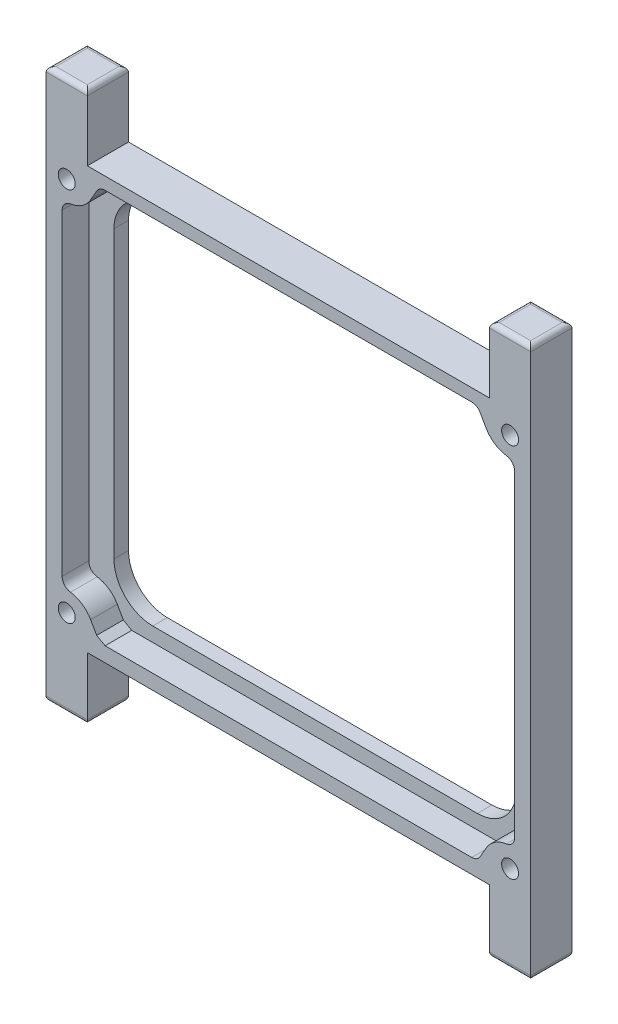
from build123d import *

# Parameters (mm, degrees)
SKETCH1_W           = 100
SKETCH1_H           = 113.5
BOSS_EXTRUDE1_DEPTH = 8.5
CUT_EXTRUDE1_REACH  = 78.111
SKETCH2_W           = 83
SKETCH2_H           = 13.5
SKETCH2_H_2         = 13
SKETCH2_W_2         = 10
SKETCH2_H_3         = 10
SKETCH2_R           = 1.75
CUT_EXTRUDE2_REACH  = 78.111
SKETCH6_W           = 10
SKETCH6_H           = 10
FILLET1_R           = 1
SKETCH8_W           = 10
SKETCH8_H           = 10
CUT_EXTRUDE5_DEPTH  = 5.5
CUT_EXTRUDE6_DEPTH  = 76.834111718


with BuildPart() as part:
    # Sketch1 → Boss-Extrude1 (new body)
    with BuildSketch(Plane.XY):
        Rectangle(SKETCH1_W, SKETCH1_H)
    extrude(amount=BOSS_EXTRUDE1_DEPTH)

    # Sketch2 → Cut-Extrude1 (cut, up to next)
    with BuildSketch(Plane.XY.offset(8.5), mode=Mode.PRIVATE) as cut_extrude1_sk1:
        with Locations((0, 50)):
            Rectangle(SKETCH2_W, SKETCH2_H)
    cut_extrude1_tool1 = extrude(cut_extrude1_sk1.sketch, amount=-CUT_EXTRUDE1_REACH, mode=Mode.PRIVATE) & part.part
    # Sketch2 → Cut-Extrude1 (cut, up to next)
    with BuildSketch(Plane.XY.offset(8.5), mode=Mode.PRIVATE) as cut_extrude1_sk2:
        with BuildLine():
            ThreePointArc((-41.5, -29.75), (-39.156854249, -35.406854249), (-33.5, -37.75))
            Line((-33.5, -37.75), (33.5, -37.75))
            ThreePointArc((33.5, -37.75), (39.156854249, -35.406854249), (41.5, -29.75))
            Line((41.5, -29.75), (41.5, -0.25))
            Line((41.5, -0.25), (-41.5, -0.25))
            Line((-41.5, -0.25), (-41.5, -29.75))
        make_face()
    cut_extrude1_tool2 = extrude(cut_extrude1_sk2.sketch, amount=-CUT_EXTRUDE1_REACH, mode=Mode.PRIVATE) & part.part
    # Sketch2 → Cut-Extrude1 (cut, up to next)
    with BuildSketch(Plane.XY.offset(8.5), mode=Mode.PRIVATE) as cut_extrude1_sk3:
        with Locations((0, -50.25)):
            Rectangle(SKETCH2_W, SKETCH2_H_2)
    cut_extrude1_tool3 = extrude(cut_extrude1_sk3.sketch, amount=-CUT_EXTRUDE1_REACH, mode=Mode.PRIVATE) & part.part
    # Sketch2 → Cut-Extrude1 (cut, up to next)
    with BuildSketch(Plane.XY.offset(8.5), mode=Mode.PRIVATE) as cut_extrude1_sk4:
        with Locations((-11.75, 22.75)):
            Rectangle(SKETCH2_W_2, SKETCH2_H_3)
    cut_extrude1_tool4 = extrude(cut_extrude1_sk4.sketch, amount=-CUT_EXTRUDE1_REACH, mode=Mode.PRIVATE) & part.part
    # Sketch2 → Cut-Extrude1 (cut, up to next)
    with BuildSketch(Plane.XY.offset(8.5), mode=Mode.PRIVATE) as cut_extrude1_sk5:
        with Locations((45.75, 38.75)):
            Circle(SKETCH2_R)
    cut_extrude1_tool5 = extrude(cut_extrude1_sk5.sketch, amount=-CUT_EXTRUDE1_REACH, mode=Mode.PRIVATE) & part.part
    # Sketch2 → Cut-Extrude1 (cut, up to next)
    with BuildSketch(Plane.XY.offset(8.5), mode=Mode.PRIVATE) as cut_extrude1_sk6:
        with Locations((45.75, -38.75)):
            Circle(SKETCH2_R)
    cut_extrude1_tool6 = extrude(cut_extrude1_sk6.sketch, amount=-CUT_EXTRUDE1_REACH, mode=Mode.PRIVATE) & part.part
    # Sketch2 → Cut-Extrude1 (cut, up to next)
    with BuildSketch(Plane.XY.offset(8.5), mode=Mode.PRIVATE) as cut_extrude1_sk7:
        with Locations((-45.75, 38.75)):
            Circle(SKETCH2_R)
    cut_extrude1_tool7 = extrude(cut_extrude1_sk7.sketch, amount=-CUT_EXTRUDE1_REACH, mode=Mode.PRIVATE) & part.part
    # Sketch2 → Cut-Extrude1 (cut, up to next)
    with BuildSketch(Plane.XY.offset(8.5), mode=Mode.PRIVATE) as cut_extrude1_sk8:
        with Locations((-45.75, -38.75)):
            Circle(SKETCH2_R)
    cut_extrude1_tool8 = extrude(cut_extrude1_sk8.sketch, amount=-CUT_EXTRUDE1_REACH, mode=Mode.PRIVATE) & part.part
    add(cut_extrude1_tool1.solids().sort_by_distance((0, 50, 8.5))[0], mode=Mode.SUBTRACT)
    add(cut_extrude1_tool2.solids().sort_by_distance((0, -18.848961, 8.5))[0], mode=Mode.SUBTRACT)
    add(cut_extrude1_tool3.solids().sort_by_distance((0, -50.25, 8.5))[0], mode=Mode.SUBTRACT)
    add(cut_extrude1_tool4.solids().sort_by_distance((-11.75, 22.75, 8.5))[0], mode=Mode.SUBTRACT)
    add(cut_extrude1_tool5.solids().sort_by_distance((45.75, 38.75, 8.5))[0], mode=Mode.SUBTRACT)
    add(cut_extrude1_tool6.solids().sort_by_distance((45.75, -38.75, 8.5))[0], mode=Mode.SUBTRACT)
    add(cut_extrude1_tool7.solids().sort_by_distance((-45.75, 38.75, 8.5))[0], mode=Mode.SUBTRACT)
    add(cut_extrude1_tool8.solids().sort_by_distance((-45.75, -38.75, 8.5))[0], mode=Mode.SUBTRACT)

    # Sketch6 → Cut-Extrude2 (cut, up to next)
    with BuildSketch(Plane.XY.offset(8.5), mode=Mode.PRIVATE) as cut_extrude2_sk1:
        with BuildLine():
            Line((41.5, 8.25), (41.5, 29.25))
            ThreePointArc((41.5, 29.25), (39.156854249, 34.906854249), (33.5, 37.25))
            Line((33.5, 37.25), (28.5, 37.25))
            Line((28.5, 37.25), (28.5, 8.25))
            Line((28.5, 8.25), (33.5, 8.25))
            Line((33.5, 8.25), (41.5, 8.25))
        make_face()
    cut_extrude2_tool1 = extrude(cut_extrude2_sk1.sketch, amount=-CUT_EXTRUDE2_REACH, mode=Mode.PRIVATE) & part.part
    # Sketch6 → Cut-Extrude2 (cut, up to next)
    with BuildSketch(Plane.XY.offset(8.5), mode=Mode.PRIVATE) as cut_extrude2_sk2:
        with Locations((11.75, 22.75)):
            Rectangle(SKETCH6_W, SKETCH6_H)
    cut_extrude2_tool2 = extrude(cut_extrude2_sk2.sketch, amount=-CUT_EXTRUDE2_REACH, mode=Mode.PRIVATE) & part.part
    # Sketch6 → Cut-Extrude2 (cut, up to next)
    with BuildSketch(Plane.XY.offset(8.5), mode=Mode.PRIVATE) as cut_extrude2_sk3:
        with BuildLine():
            Line((-41.5, 8.25), (-41.5, 29.25))
            ThreePointArc((-41.5, 29.25), (-39.156854249, 34.906854249), (-33.5, 37.25))
            Line((-33.5, 37.25), (-28.5, 37.25))
            Line((-28.5, 37.25), (-28.5, 8.25))
            Line((-28.5, 8.25), (-33.5, 8.25))
            Line((-33.5, 8.25), (-41.5, 8.25))
        make_face()
    cut_extrude2_tool3 = extrude(cut_extrude2_sk3.sketch, amount=-CUT_EXTRUDE2_REACH, mode=Mode.PRIVATE) & part.part
    add(cut_extrude2_tool1.solids().sort_by_distance((34.821806, 22.269339, 8.5))[0], mode=Mode.SUBTRACT)
    add(cut_extrude2_tool2.solids().sort_by_distance((11.75, 22.75, 8.5))[0], mode=Mode.SUBTRACT)
    add(cut_extrude2_tool3.solids().sort_by_distance((-34.821806, 22.269339, 8.5))[0], mode=Mode.SUBTRACT)

    # Fillet1
    fillet1_edges = [part.edges().sort_by_distance(p)[0] for p in [
        (45.75, -56.75, 0),
        (-45.75, 56.75, 0),
        (-45.75, -56.75, 8.5),
        (-45.75, 56.75, 8.5),
        (45.75, -56.75, 8.5),
        (-41.5, 56.75, 4.25),
        (41.5, 56.75, 4.25),
        (41.5, -56.75, 4.25),
        (-41.5, -56.75, 4.25),
        (-45.75, -56.75, 0),
        (45.75, 56.75, 0),
        (50, -56.75, 4.25),
        (-50, -56.75, 4.25),
        (-50, 56.75, 4.25),
        (50, 56.75, 4.25),
        (45.75, 56.75, 8.5),
    ]]
    fillet(fillet1_edges, radius=FILLET1_R)

    # Sketch8 → Cut-Extrude5 (cut)
    with BuildSketch(Plane.XY.offset(8.5)):
        with BuildLine():
            ThreePointArc((-46.701116722, 32.72), (-46.210984272, 34.031299083), (-44.981116722, 34.7))
            ThreePointArc((-44.981116722, 34.7), (-42.571113581, 35.629410248), (-40.811116722, 37.52))
            Line((-40.811116722, 37.52), (-39.567050808, 39.7))
            ThreePointArc((-39.567050808, 39.7), (-38.836346779, 40.434383498), (-37.835, 40.7))
            Line((-37.835, 40.7), (37.835, 40.7))
            ThreePointArc((37.835, 40.7), (38.836346779, 40.434383498), (39.567050808, 39.7))
            Line((39.567050808, 39.7), (40.811116722, 37.52))
            ThreePointArc((40.811116722, 37.52), (42.571113581, 35.629410248), (44.981116722, 34.7))
            ThreePointArc((44.981116722, 34.7), (46.210984272, 34.031299083), (46.701116722, 32.72))
            Line((46.701116722, 32.72), (46.701116722, -32.72))
            ThreePointArc((46.701116722, -32.72), (46.210984272, -34.031299083), (44.981116722, -34.7))
            ThreePointArc((44.981116722, -34.7), (42.571113581, -35.629410248), (40.811116722, -37.52))
            Line((40.811116722, -37.52), (39.567050808, -39.7))
            ThreePointArc((39.567050808, -39.7), (38.836346779, -40.434383498), (37.835, -40.7))
            Line((37.835, -40.7), (-37.835, -40.7))
            Line((-37.835, -40.7), (-39.567050808, -39.7))
            Line((-39.567050808, -39.7), (-40.811116722, -37.52))
            ThreePointArc((-40.811116722, -37.52), (-42.571113581, -35.629410248), (-44.981116722, -34.7))
            ThreePointArc((-44.981116722, -34.7), (-46.210984272, -34.031299083), (-46.701116722, -32.72))
            Line((-46.701116722, -32.72), (-46.701116722, 32.72))
        make_face()
        with Locations((-11.75, 22.75)):
            Rectangle(SKETCH8_W, SKETCH8_H, mode=Mode.SUBTRACT)
        with BuildLine():
            Line((33.5, -37.75), (-33.5, -37.75))
            ThreePointArc((-33.5, -37.75), (-39.156854249, -35.406854249), (-41.5, -29.75))
            Line((-41.5, -29.75), (-41.5, -0.25))
            Line((-41.5, -0.25), (41.5, -0.25))
            Line((41.5, -0.25), (41.5, -29.75))
            ThreePointArc((41.5, -29.75), (39.156854249, -35.406854249), (33.5, -37.75))
        make_face(mode=Mode.SUBTRACT)
        with Locations((11.75, 22.75)):
            Rectangle(SKETCH8_W, SKETCH8_H, mode=Mode.SUBTRACT)
        with BuildLine():
            Line((-41.5, 8.25), (-41.5, 29.25))
            ThreePointArc((-41.5, 29.25), (-39.156854249, 34.906854249), (-33.5, 37.25))
            Line((-33.5, 37.25), (-28.5, 37.25))
            Line((-28.5, 37.25), (-28.5, 8.25))
            Line((-28.5, 8.25), (-41.5, 8.25))
        make_face(mode=Mode.SUBTRACT)
        with BuildLine():
            Line((41.5, 8.25), (28.5, 8.25))
            Line((28.5, 8.25), (28.5, 37.25))
            Line((28.5, 37.25), (33.5, 37.25))
            ThreePointArc((33.5, 37.25), (39.156854249, 34.906854249), (41.5, 29.25))
            Line((41.5, 29.25), (41.5, 8.25))
        make_face(mode=Mode.SUBTRACT)
    extrude(amount=-CUT_EXTRUDE5_DEPTH, mode=Mode.SUBTRACT)

    # Sketch9 → Cut-Extrude6 (cut, through all)
    with BuildSketch(Plane.XY.offset(3)):
        with BuildLine():
            Line((-33.5, -37.75), (33.5, -37.75))
            ThreePointArc((33.5, -37.75), (39.156854249, -35.406854249), (41.5, -29.75))
            Line((41.5, -29.75), (41.5, 29.25))
            ThreePointArc((41.5, 29.25), (39.156854249, 34.906854249), (33.5, 37.25))
            Line((33.5, 37.25), (-33.5, 37.25))
            ThreePointArc((-33.5, 37.25), (-39.156854249, 34.906854249), (-41.5, 29.25))
            Line((-41.5, 29.25), (-41.5, -29.75))
            ThreePointArc((-41.5, -29.75), (-39.156854249, -35.406854249), (-33.5, -37.75))
        make_face()
    extrude(amount=-CUT_EXTRUDE6_DEPTH, mode=Mode.SUBTRACT)


solid = part.part
